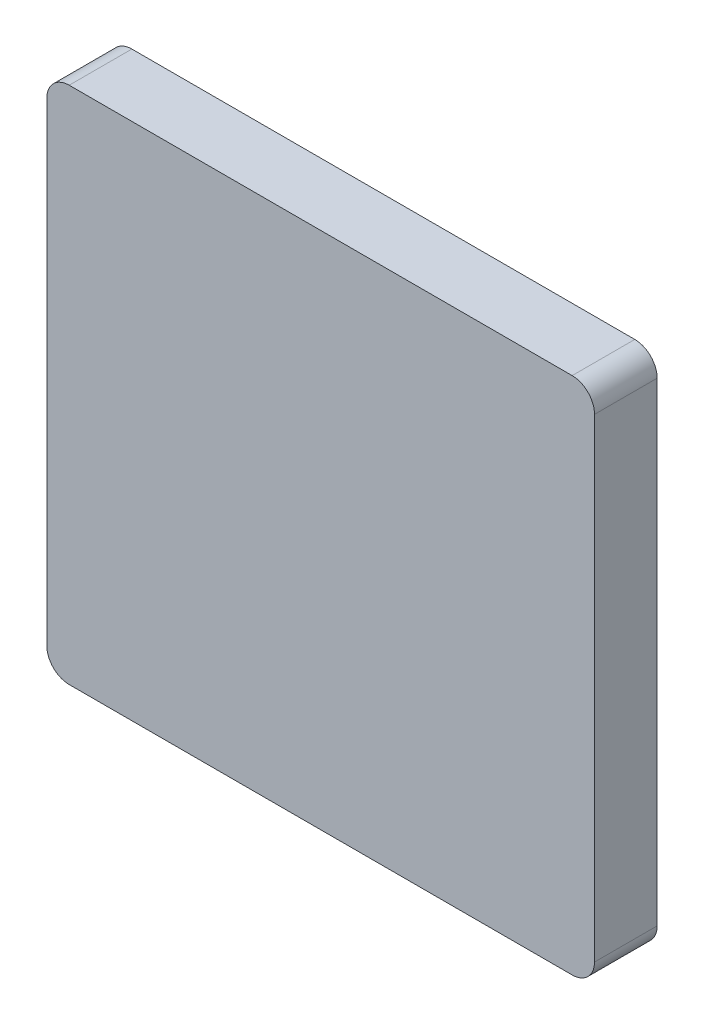
from build123d import *

# Parameters (mm, degrees)
SKETCH1_W           = 612
SKETCH1_H           = 580
BOSS_EXTRUDE1_DEPTH = 70
FILLET1_R           = 25


with BuildPart() as part:
    # Sketch1 → Boss-Extrude1 (new body)
    with BuildSketch(Plane.XY):
        with Locations((-140.153846154, 0)):
            Rectangle(SKETCH1_W, SKETCH1_H)
    extrude(amount=BOSS_EXTRUDE1_DEPTH)

    # Fillet1
    fillet1_edges = [part.edges().sort_by_distance(p)[0] for p in [
        (165.846153846, -290, 35),
        (-446.153846154, -290, 35),
        (-446.153846154, 290, 35),
        (165.846153846, 290, 35),
    ]]
    fillet(fillet1_edges, radius=FILLET1_R)


solid = part.part
